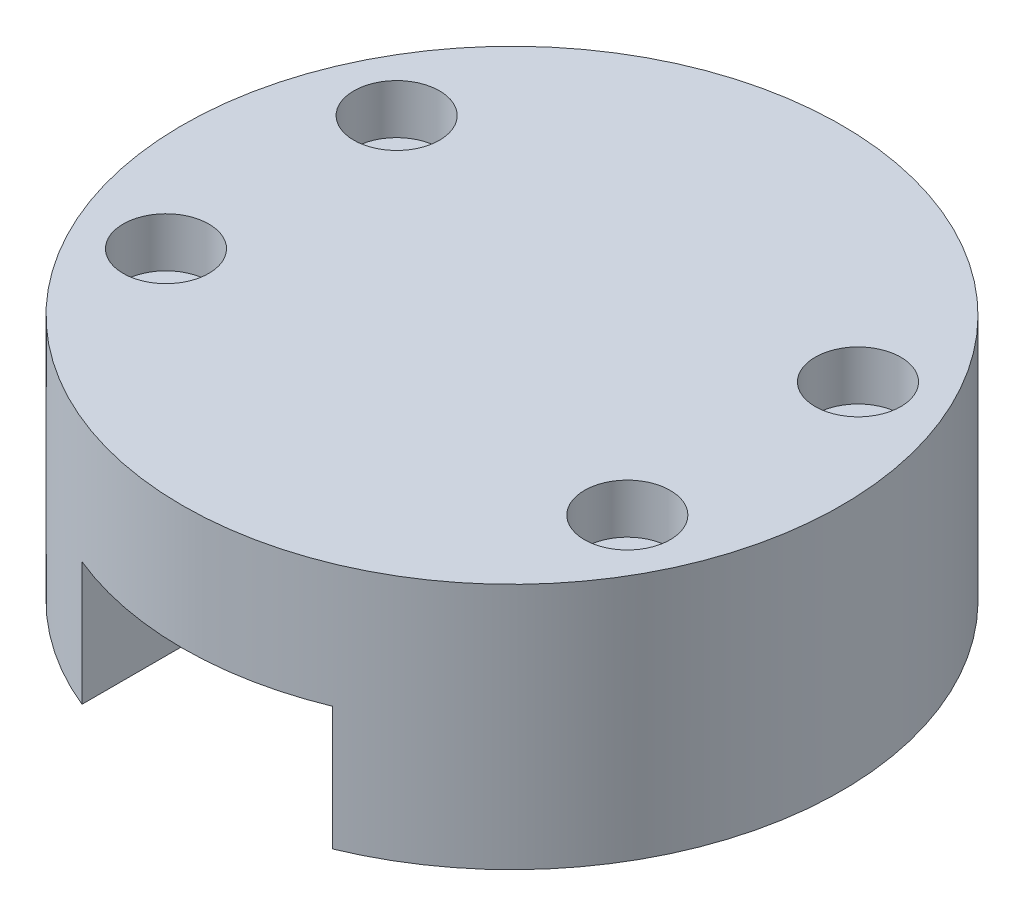
from build123d import *

# Parameters (mm, degrees)
SKETCH1_R               = 20
BOSS_EXTRUDE1_DEPTH     = 15
CUT_EXTRUDE1_DEPTH      = 25
CUT_EXTRUDE1_DEPTH_BACK = 25
SKETCH2_W               = 15.2
SKETCH2_H               = 7.5
CUT_EXTRUDE2_REACH      = 34.016
SKETCH3_R               = 1.5
SKETCH4_R               = 2.6
CUT_EXTRUDE3_DEPTH      = 3


with BuildPart() as part:
    # Sketch1 → Boss-Extrude1 (new body)
    with BuildSketch(Plane(origin=(0, 0, 0), x_dir=(1, 0, 0), z_dir=(0, 1, 0))):
        Circle(SKETCH1_R)
    extrude(amount=BOSS_EXTRUDE1_DEPTH)

    # Sketch2 → Cut-Extrude1 (cut, two sides: drawn at the far end of the back side and taken through both)
    with BuildSketch(Plane.XY.offset(-CUT_EXTRUDE1_DEPTH_BACK)):
        with Locations((0, 3.75)):
            Rectangle(SKETCH2_W, SKETCH2_H)
    extrude(amount=CUT_EXTRUDE1_DEPTH + CUT_EXTRUDE1_DEPTH_BACK, mode=Mode.SUBTRACT)

    # Sketch3 → Cut-Extrude2 (cut, up to next)
    with BuildSketch(Plane(origin=(0, 0, 0), x_dir=(-1, 0, 0), z_dir=(0, -1, 0)), mode=Mode.PRIVATE) as cut_extrude2_sk1:
        with Locations((14, -7)):
            Circle(SKETCH3_R)
    cut_extrude2_tool1 = extrude(cut_extrude2_sk1.sketch, amount=-CUT_EXTRUDE2_REACH, mode=Mode.PRIVATE) & part.part
    # Sketch3 → Cut-Extrude2 (cut, up to next)
    with BuildSketch(Plane(origin=(0, 0, 0), x_dir=(-1, 0, 0), z_dir=(0, -1, 0)), mode=Mode.PRIVATE) as cut_extrude2_sk2:
        with Locations((14, 7)):
            Circle(SKETCH3_R)
    cut_extrude2_tool2 = extrude(cut_extrude2_sk2.sketch, amount=-CUT_EXTRUDE2_REACH, mode=Mode.PRIVATE) & part.part
    # Sketch3 → Cut-Extrude2 (cut, up to next)
    with BuildSketch(Plane(origin=(0, 0, 0), x_dir=(-1, 0, 0), z_dir=(0, -1, 0)), mode=Mode.PRIVATE) as cut_extrude2_sk3:
        with Locations((-14, -7)):
            Circle(SKETCH3_R)
    cut_extrude2_tool3 = extrude(cut_extrude2_sk3.sketch, amount=-CUT_EXTRUDE2_REACH, mode=Mode.PRIVATE) & part.part
    # Sketch3 → Cut-Extrude2 (cut, up to next)
    with BuildSketch(Plane(origin=(0, 0, 0), x_dir=(-1, 0, 0), z_dir=(0, -1, 0)), mode=Mode.PRIVATE) as cut_extrude2_sk4:
        with Locations((-14, 7)):
            Circle(SKETCH3_R)
    cut_extrude2_tool4 = extrude(cut_extrude2_sk4.sketch, amount=-CUT_EXTRUDE2_REACH, mode=Mode.PRIVATE) & part.part
    add(cut_extrude2_tool1.solids().sort_by_distance((-14, 0, 7))[0], mode=Mode.SUBTRACT)
    add(cut_extrude2_tool2.solids().sort_by_distance((-14, 0, -7))[0], mode=Mode.SUBTRACT)
    add(cut_extrude2_tool3.solids().sort_by_distance((14, 0, 7))[0], mode=Mode.SUBTRACT)
    add(cut_extrude2_tool4.solids().sort_by_distance((14, 0, -7))[0], mode=Mode.SUBTRACT)

    # Sketch4 → Cut-Extrude3 (cut)
    with BuildSketch(Plane(origin=(0, 15, 0), x_dir=(1, 0, 0), z_dir=(0, 1, 0))):
        with Locations((-14, 7)):
            Circle(SKETCH4_R)
        with Locations((-14, -7)):
            Circle(SKETCH4_R)
        with Locations((14, 7)):
            Circle(SKETCH4_R)
        with Locations((14, -7)):
            Circle(SKETCH4_R)
    extrude(amount=-CUT_EXTRUDE3_DEPTH, mode=Mode.SUBTRACT)


solid = part.part
